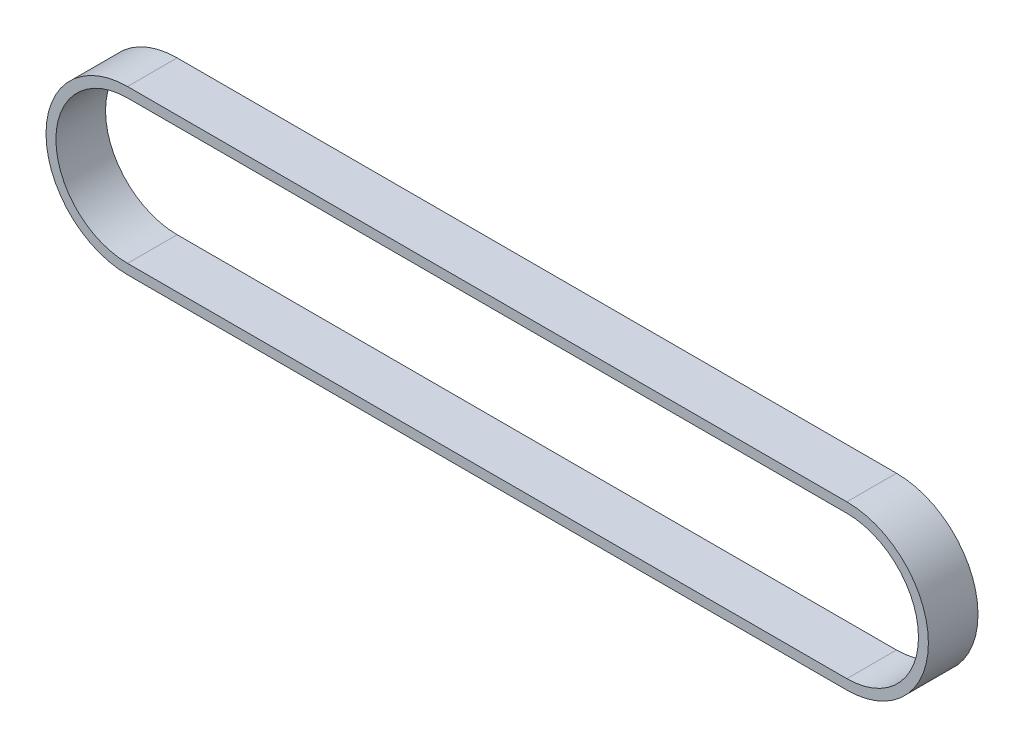
from build123d import *

# Parameters (mm, degrees)
SHEET_EXTRUDE_1_1_DEPTH = 10
THICKEN_1_T1            = 2


with BuildPart() as body_1:
    # Sheet Extrude 1: a surface, the sketch's curves swept straight by 10 mm
    with BuildLine(Plane.XY, mode=Mode.PRIVATE) as sheet_extrude_1_1_path:
        Line((0, -14.435), (-145, -14.435))
        ThreePointArc((-145, -14.435), (-159.435, 0), (-145, 14.435))
        Line((-145, 14.435), (0, 14.435))
        ThreePointArc((0, 14.435), (14.435, 0), (0, -14.435))
    sheet_extrude_1_1 = Shell.extrude(sheet_extrude_1_1_path.wire(), (0 * SHEET_EXTRUDE_1_1_DEPTH, 0 * SHEET_EXTRUDE_1_1_DEPTH, 1 * SHEET_EXTRUDE_1_1_DEPTH))
    add(Solid.thicken(sheet_extrude_1_1, THICKEN_1_T1))


solid = body_1.part
